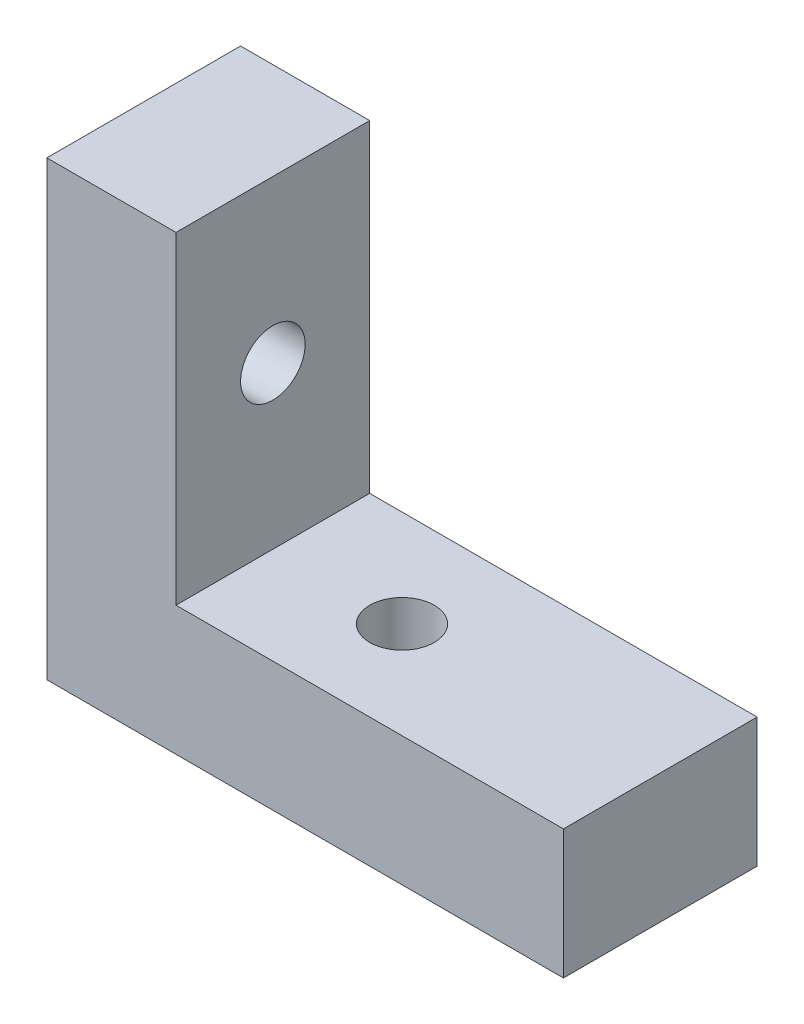
from build123d import *

# Parameters (mm, degrees)
SKETCH1_W           = 80
SKETCH1_H           = 30
BOSS_EXTRUDE1_DEPTH = 20
SKETCH2_W           = 20
SKETCH2_H           = 30
BOSS_EXTRUDE2_DEPTH = 50
SKETCH3_R           = 5
CUT_EXTRUDE1_DEPTH  = 50
SKETCH4_R           = 5
CUT_EXTRUDE2_DEPTH  = 50


with BuildPart() as part:
    # Sketch1 → Boss-Extrude1 (new body)
    with BuildSketch(Plane(origin=(0, 0, 0), x_dir=(1, 0, 0), z_dir=(0, 1, 0))):
        Rectangle(SKETCH1_W, SKETCH1_H)
    extrude(amount=BOSS_EXTRUDE1_DEPTH)

    # Sketch2 → Boss-Extrude2 (add)
    with BuildSketch(Plane(origin=(0, 20, 0), x_dir=(1, 0, 0), z_dir=(0, 1, 0))):
        with Locations((-30, 0)):
            Rectangle(SKETCH2_W, SKETCH2_H)
    extrude(amount=BOSS_EXTRUDE2_DEPTH)

    # Sketch3 → Cut-Extrude1 (cut)
    with BuildSketch(Plane(origin=(0, 20, 0), x_dir=(1, 0, 0), z_dir=(0, 1, 0))):
        with Locations(Location((0, 0, 0), (0, 0, 270))):
            Circle(SKETCH3_R)
    extrude(amount=-CUT_EXTRUDE1_DEPTH, mode=Mode.SUBTRACT)

    # Sketch4 → Cut-Extrude2 (cut)
    with BuildSketch(Plane(origin=(-20, 0, 0), x_dir=(0, 0, -1), z_dir=(1, 0, 0))):
        with Locations((0, 45)):
            Circle(SKETCH4_R)
    extrude(amount=-CUT_EXTRUDE2_DEPTH, mode=Mode.SUBTRACT)


solid = part.part
